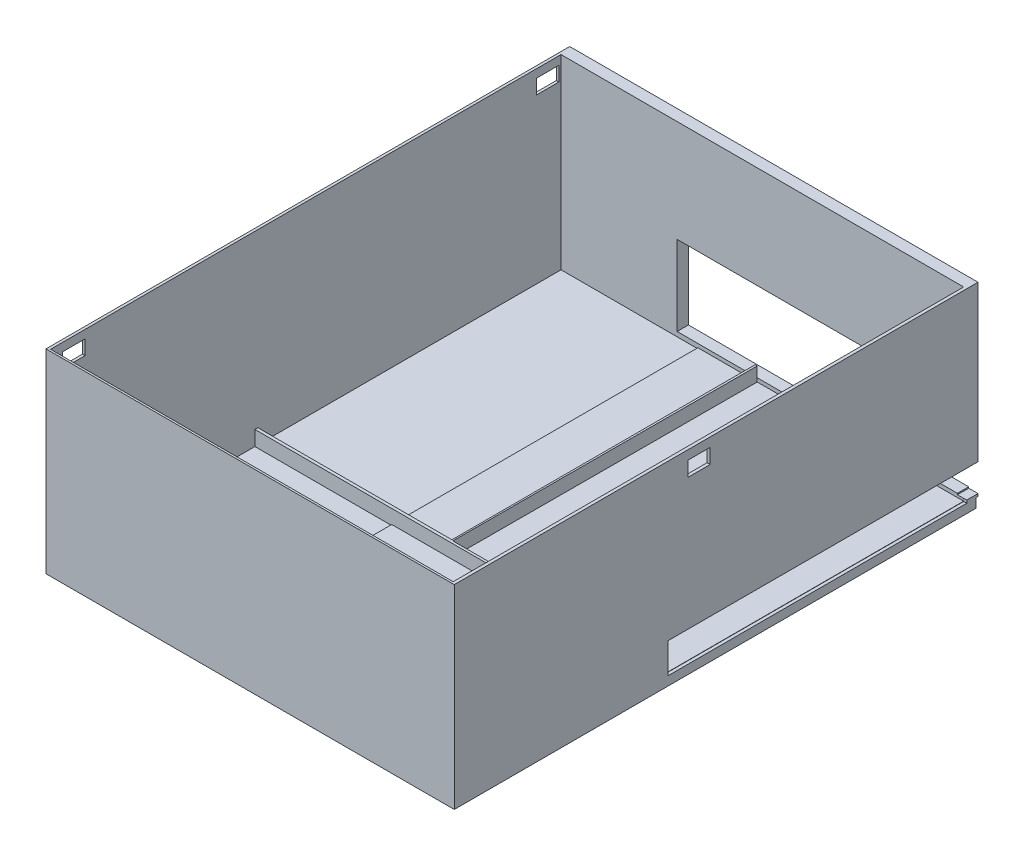
from build123d import *

# Parameters (mm, degrees)
SKETCH1_W            = 76.15972441
SKETCH1_H            = 126.932874018
BOSS_EXTRUDE1_DEPTH  = 2.54
BOSS_EXTRUDE4_DEPTH  = 38.1
SHELL1_T             = -2.54
BOSS_EXTRUDE5_DEPTH  = 6.35
SKETCH16_W           = 76.15972441
SKETCH16_H           = 40.64
CUT_EXTRUDE7_DEPTH   = 7.112
SKETCH17_W           = 71.07972441
SKETCH17_H           = 3.09636258
CUT_EXTRUDE8_DEPTH   = 4.064
SKETCH19_W           = 35.651407884
SKETCH19_H           = 127.489236598
BOSS_EXTRUDE19_DEPTH = 2.286
SKETCH26_W           = 127.489236598
SKETCH26_H           = 38.354
CUT_EXTRUDE10_DEPTH  = 2.54
BOSS_EXTRUDE20_DEPTH = 40.64
SKETCH28_W           = 111.811132294
SKETCH28_H           = 15.936917459
BOSS_EXTRUDE21_DEPTH = 2.54
SKETCH34_W           = 111.811132294
SKETCH34_H           = 38.1
CUT_EXTRUDE12_DEPTH  = 5.08
BOSS_EXTRUDE23_DEPTH = 40.64
BOSS_EXTRUDE24_DEPTH = 6.35
BOSS_EXTRUDE28_DEPTH = 12.7
BOSS_EXTRUDE29_DEPTH = 27.94
SKETCH54_W           = 6.207163676
SKETCH54_H           = 3.981954056
CUT_EXTRUDE20_DEPTH  = 15.24
SKETCH55_W           = 6.104333468
SKETCH55_H           = 4.061705803
CUT_EXTRUDE21_DEPTH  = 15.24
SKETCH56_W           = 1.706619681
SKETCH56_H           = 138.67981609
CUT_EXTRUDE22_DEPTH  = 38.1
SKETCH57_W           = 5.678434708
SKETCH57_H           = 21.844
CUT_EXTRUDE23_DEPTH  = 38.1
CUT_EXTRUDE24_DEPTH  = 2.54
SKETCH59_W           = 110.26035724
SKETCH59_H           = 1.116448274
CUT_EXTRUDE25_DEPTH  = 38.1
SKETCH61_W           = 1.706619681
SKETCH61_H           = 14.640018444
CUT_EXTRUDE26_DEPTH  = 4.064
CUT_EXTRUDE28_DEPTH  = 0.762


with BuildPart() as part:
    # Sketch1 → Boss-Extrude1 (new body)
    with BuildSketch(Plane(origin=(0, 0, 0), x_dir=(1, 0, 0), z_dir=(0, 1, 0))):
        with Locations((0.933329956, -31.079887535)):
            Rectangle(SKETCH1_W, SKETCH1_H)
    extrude(amount=BOSS_EXTRUDE1_DEPTH)

    # Sketch7 → Boss-Extrude4 (add)
    with BuildSketch(Plane(origin=(0, 2.54, 0), x_dir=(1, 0, 0), z_dir=(0, 1, 0))):
        Polygon((-37.146532249, 32.386549474), (-37.146532249, -94.546324544), (39.013192161, -94.546324544), (39.013192161, 32.386549474), (39.013192161, 37.514912054), (-37.146532249, 37.514912054), align=None)
    extrude(amount=BOSS_EXTRUDE4_DEPTH)

    # Shell1
    shell1_openings = [part.faces().sort_by_distance(p)[0] for p in [
        (0.933329956, 40.64, 28.515706245),
    ]]
    offset(amount=SHELL1_T, openings=shell1_openings, kind=Kind.INTERSECTION)

    # Sketch12 → Boss-Extrude5 (add)
    with BuildSketch(Plane(origin=(0, 0, 0), x_dir=(1, 0, 0), z_dir=(0, 1, 0))):
        Polygon((-17.752421588, -53.993703886), (39.013192161, -53.993703886), (39.013192161, -53.328667969), (-17.752421588, -53.328667969), (-18.535651553, -53.328667969), (-18.344689589, 32.386549474), (-18.927981394, 32.386549474), (-18.927981394, -53.993703886), (-18.28148375, -53.993703886), align=None)
    extrude(amount=BOSS_EXTRUDE5_DEPTH)

    # Sketch16 → Cut-Extrude7 (cut)
    with BuildSketch(Plane(origin=(0, 0, -40.054912054), x_dir=(-1, 0, 0), z_dir=(0, 0, -1))):
        with Locations((-0.933329956, 20.32)):
            Rectangle(SKETCH16_W, SKETCH16_H)
    extrude(amount=-CUT_EXTRUDE7_DEPTH, mode=Mode.SUBTRACT)

    # Sketch17 → Cut-Extrude8 (cut)
    with BuildSketch(Plane(origin=(0, 7.62, 0), x_dir=(1, 0, 0), z_dir=(0, 1, 0))):
        with Locations((0.933329956, 31.394730764)):
            Rectangle(SKETCH17_W, SKETCH17_H)
    extrude(amount=-CUT_EXTRUDE8_DEPTH, mode=Mode.SUBTRACT)

    # Sketch19 → Boss-Extrude19 (add)
    with BuildSketch(Plane(origin=(0, 0, 0), x_dir=(1, 0, 0), z_dir=(0, 1, 0))):
        with Locations((-54.972236191, -30.801706245)):
            Rectangle(SKETCH19_W, SKETCH19_H)
    extrude(amount=BOSS_EXTRUDE19_DEPTH)

    # Sketch26 → Cut-Extrude10 (cut)
    with BuildSketch(Plane.ZY.offset(37.146532249)):
        with Locations((30.801706245, 21.463)):
            Rectangle(SKETCH26_W, SKETCH26_H)
    extrude(amount=-CUT_EXTRUDE10_DEPTH, mode=Mode.SUBTRACT)

    # Sketch27 → Boss-Extrude20 (add)
    with BuildSketch(Plane(origin=(0, 0, 0), x_dir=(1, 0, 0), z_dir=(0, 1, 0))):
        Polygon((-34.606532249, -94.546324544), (-72.797940133, -94.546324544), (-72.797940133, 32.942912054), (-34.606532249, 32.942912054), (-34.606532249, 29.846549474), (-72.080545398, 29.846549474), (-72.080545398, -92.006324544), (-70.104362866, -92.006324544), (-34.606532249, -92.006324544), align=None)
    extrude(amount=BOSS_EXTRUDE20_DEPTH)

    # Sketch28 → Boss-Extrude21 (add)
    with BuildSketch(Plane(origin=(0, 0, 0), x_dir=(1, 0, 0), z_dir=(0, 1, 0))):
        with Locations((-16.892373986, -102.514783274)):
            Rectangle(SKETCH28_W, SKETCH28_H)
    extrude(amount=BOSS_EXTRUDE21_DEPTH)

    # Sketch34 → Cut-Extrude12 (cut)
    with BuildSketch(Plane.XY.offset(97.086324544)):
        with Locations((-16.892373986, 21.59)):
            Rectangle(SKETCH34_W, SKETCH34_H)
    extrude(amount=-CUT_EXTRUDE12_DEPTH, mode=Mode.SUBTRACT)

    # Sketch36 → Boss-Extrude23 (add)
    with BuildSketch(Plane(origin=(0, 0, 0), x_dir=(1, 0, 0), z_dir=(0, 1, 0))):
        Polygon((-72.797940133, -92.006324544), (-72.797940133, -110.483242003), (39.013192161, -110.483242003), (39.013192161, -92.006324544), (36.473192161, -92.006324544), (36.473192161, -108.833266616), (-72.080545398, -108.833266616), (-72.080545398, -92.006324544), align=None)
    extrude(amount=BOSS_EXTRUDE23_DEPTH)

    # Sketch39 → Boss-Extrude24 (add)
    with BuildSketch(Plane(origin=(0, 0, 0), x_dir=(1, 0, 0), z_dir=(0, 1, 0))):
        Polygon((-19.575673417, -53.993703886), (-72.080545398, -53.993703886), (-72.080545398, -53.1861939), (-19.575673417, -53.1861939), (-18.927981394, -53.1861939), (-18.927981394, -53.993703886), align=None)
    extrude(amount=BOSS_EXTRUDE24_DEPTH)

    # Sketch51 → Boss-Extrude28 (add)
    with BuildSketch(Plane(origin=(0, 40.64, 0), x_dir=(1, 0, 0), z_dir=(0, 1, 0))):
        Polygon((-34.606532249, 32.942912054), (-34.606532249, 29.846549474), (-72.080545398, 29.846549474), (-72.080545398, -108.833266616), (-72.080545398, -109.553098124), (-72.080545398, -109.94971489), (38.179811842, -109.94971489), (38.179811842, -109.553098124), (38.179811842, 32.942912054), (39.013192161, 32.942912054), (39.013192161, -110.483242003), (-72.797940133, -110.483242003), (-72.797940133, 32.942912054), align=None)
    extrude(amount=BOSS_EXTRUDE28_DEPTH)

    # Sketch52 → Boss-Extrude29 (add)
    with BuildSketch(Plane(origin=(0, 53.34, 0), x_dir=(1, 0, 0), z_dir=(0, 1, 0))):
        Polygon((38.179811842, 32.942912054), (38.179811842, 29.846549474), (-34.606532249, 29.846549474), (-39.725324066, 29.846549474), (-39.725324066, 32.942912054), (-34.606532249, 32.942912054), align=None)
    extrude(amount=-BOSS_EXTRUDE29_DEPTH)

    # Sketch54 → Cut-Extrude20 (cut)
    with BuildSketch(Plane.ZY.offset(72.797940133)):
        with Locations((103.598874165, 49.097770639)):
            Rectangle(SKETCH54_W, SKETCH54_H)
        with Locations((-26.170821026, 49.097770639)):
            Rectangle(SKETCH54_W, SKETCH54_H)
    extrude(amount=-CUT_EXTRUDE20_DEPTH, mode=Mode.SUBTRACT)

    # Sketch55 → Cut-Extrude21 (cut)
    with BuildSketch(Plane(origin=(41.553192161, 0, 0), x_dir=(0, 0, -1), z_dir=(1, 0, 0))):
        with Locations((-43.456564529, 48.820045114)):
            Rectangle(SKETCH55_W, SKETCH55_H)
    extrude(amount=-CUT_EXTRUDE21_DEPTH, mode=Mode.SUBTRACT)

    # Sketch56 → Cut-Extrude22 (cut)
    with BuildSketch(Plane(origin=(0, 40.64, 0), x_dir=(1, 0, 0), z_dir=(0, 1, 0))):
        with Locations((37.326502002, -39.493358571)):
            Rectangle(SKETCH56_W, SKETCH56_H)
    extrude(amount=-CUT_EXTRUDE22_DEPTH, mode=Mode.SUBTRACT)

    # Sketch57 → Cut-Extrude23 (cut)
    with BuildSketch(Plane(origin=(0, 0, -32.942912054), x_dir=(-1, 0, 0), z_dir=(0, 0, -1))):
        with Locations((37.445749603, 14.478)):
            Rectangle(SKETCH57_W, SKETCH57_H)
    extrude(amount=-CUT_EXTRUDE23_DEPTH, mode=Mode.SUBTRACT)

    # Sketch58 → Cut-Extrude24 (cut)
    with BuildSketch(Plane(origin=(39.013192161, 0, 0), x_dir=(0, 0, -1), z_dir=(1, 0, 0))):
        Polygon((-51.99249987, 3.220445107), (32.386549474, 3.220445107), (32.942912054, 3.220445107), (32.942912054, 3.900890214), (32.942912054, 10.759981556), (-51.99249987, 10.759981556), align=None)
    extrude(amount=-CUT_EXTRUDE24_DEPTH, mode=Mode.SUBTRACT)

    # Sketch59 → Cut-Extrude25 (cut)
    with BuildSketch(Plane(origin=(0, 40.64, 0), x_dir=(1, 0, 0), z_dir=(0, 1, 0))):
        with Locations((-16.950366778, -109.391490753)):
            Rectangle(SKETCH59_W, SKETCH59_H)
    extrude(amount=-CUT_EXTRUDE25_DEPTH, mode=Mode.SUBTRACT)

    # Sketch61 → Cut-Extrude26 (cut)
    with BuildSketch(Plane.XY.offset(-29.846549474)):
        with Locations((37.326502002, 18.079990778)):
            Rectangle(SKETCH61_W, SKETCH61_H)
    extrude(amount=-CUT_EXTRUDE26_DEPTH, mode=Mode.SUBTRACT)

    # Sketch62 → Cut-Extrude28 (cut)
    with BuildSketch(Plane(origin=(0, 3.220445107, 0), x_dir=(1, 0, 0), z_dir=(0, 1, 0))):
        Polygon((38.179811842, -51.99249987), (39.013192161, -51.99249987), (39.013192161, 29.899968422), (38.179811842, 29.846549474), align=None)
    extrude(amount=-CUT_EXTRUDE28_DEPTH, mode=Mode.SUBTRACT)


solid = part.part
